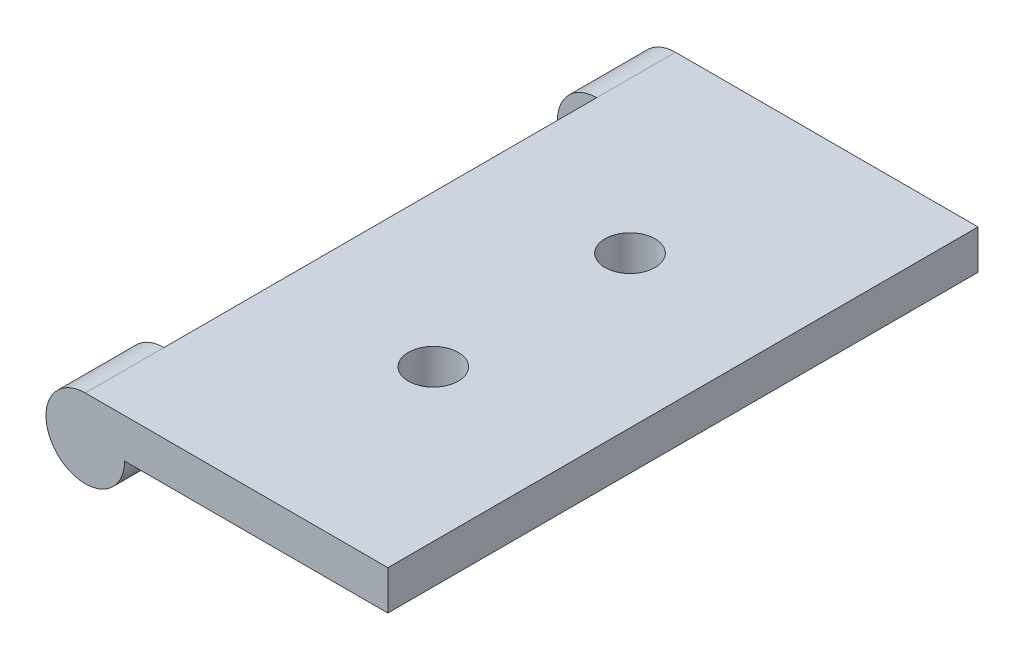
from build123d import *

# Parameters (mm, degrees)
SKETCH1_W           = 38.452994616
SKETCH1_H           = 5
BOSS_EXTRUDE1_DEPTH = 75
BOSS_EXTRUDE2_DEPTH = 10
BOSS_EXTRUDE4_DEPTH = 75
BOSS_EXTRUDE5_START = -65
BOSS_EXTRUDE5_DEPTH = 10
CUT_EXTRUDE7_START  = -10
CUT_EXTRUDE7_DEPTH  = 55
SKETCH5_R           = 3.175
CUT_EXTRUDE8_DEPTH  = 55


with BuildPart() as part:
    # Sketch1 → Boss-Extrude1 (new body)
    with BuildSketch(Plane.XY):
        with Locations((25, -2.5)):
            Rectangle(SKETCH1_W, SKETCH1_H)
    extrude(amount=-BOSS_EXTRUDE1_DEPTH)

    # Sketch1<4> → Boss-Extrude2 (add)
    with BuildSketch(Plane.XY):
        with BuildLine():
            ThreePointArc((5.773502692, 0), (2.237968786, -8.535533906), (10.773502692, -5))
            Line((10.773502692, -5), (5.773502692, -5))
            Line((5.773502692, -5), (5.773502692, 0))
        make_face()
    extrude(amount=-BOSS_EXTRUDE2_DEPTH)

    # Sketch1<11> → Boss-Extrude4 (add)
    with BuildSketch(Plane.XY):
        with BuildLine():
            Line((5.773502692, -5), (5.773502692, -2.5))
            ThreePointArc((5.773502692, -2.5), (4.005735739, -6.767766953), (8.273502692, -5))
            Line((8.273502692, -5), (5.773502692, -5))
        make_face()
    extrude(amount=-BOSS_EXTRUDE4_DEPTH)

    # Sketch1<12> → Boss-Extrude5 (add)
    with BuildSketch(Plane.XY.offset(BOSS_EXTRUDE5_START)):
        with BuildLine():
            Line((5.773502692, -2.5), (5.773502692, 0))
            ThreePointArc((5.773502692, 0), (3.273502704, -0.669872974), (1.443375686, -2.499999977))
            ThreePointArc((1.443375686, -2.499999977), (4.479407453, -9.829629128), (10.773502692, -5))
            Line((10.773502692, -5), (8.273502692, -5))
            ThreePointArc((8.273502692, -5), (4.005735739, -6.767766953), (5.773502692, -2.5))
        make_face()
    extrude(amount=-BOSS_EXTRUDE5_DEPTH)

    # Sketch1<13> → Cut-Extrude7 (cut)
    with BuildSketch(Plane.XY.offset(CUT_EXTRUDE7_START)):
        with BuildLine():
            ThreePointArc((10.773502692, -5), (9.309036598, -1.464466094), (5.773502692, 0))
            Line((5.773502692, 0), (5.773502692, -2.5))
            ThreePointArc((5.773502692, -2.5), (7.541269645, -3.232233047), (8.273502692, -5))
            Line((8.273502692, -5), (10.773502692, -5))
        make_face()
    extrude(amount=-CUT_EXTRUDE7_DEPTH, mode=Mode.SUBTRACT)

    # Sketch5 → Cut-Extrude8 (cut)
    with BuildSketch(Plane.XZ.offset(5)):
        with Locations((25, -25)):
            Circle(SKETCH5_R)
        with Locations((25, -50)):
            Circle(SKETCH5_R)
    extrude(amount=-CUT_EXTRUDE8_DEPTH, mode=Mode.SUBTRACT)


solid = part.part
